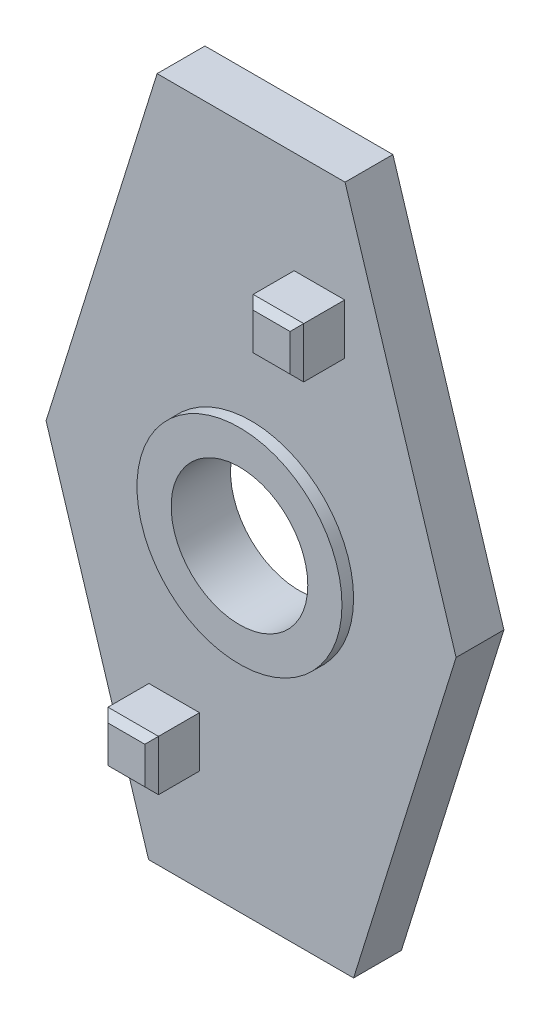
from build123d import *

# Parameters (mm, degrees)
SKETCH1_R           = 10
BOSS_EXTRUDE1_DEPTH = 7
SKETCH1_3_W         = 7.4
SKETCH1_3_H         = 7.4
BOSS_EXTRUDE2_DEPTH = 7
CHAMFER1_SIZE       = 1
BOSS_EXTRUDE3_START = 1.7
SKETCH1_4_R         = 15
SKETCH1_4_R_2       = 10
BOSS_EXTRUDE3_DEPTH = 1.7


with BuildPart() as part:
    # Sketch1 → Boss-Extrude1 (new body)
    with BuildSketch(Plane.XY):
        Polygon((-30, 0), (-15, -48.118283633), (15, -48.118283633), (30, 0), (13.753072731, 52.118283633), (-13.753072731, 52.118283633), align=None)
        Circle(SKETCH1_R, mode=Mode.SUBTRACT)
    extrude(amount=-BOSS_EXTRUDE1_DEPTH)

    # Sketch1<3> → Boss-Extrude2 (add)
    with BuildSketch(Plane.XY):
        with Locations((10.003072731, 33.468283633)):
            Rectangle(SKETCH1_3_W, SKETCH1_3_H)
        with Locations((-11.25, -29.468283633)):
            Rectangle(SKETCH1_3_W, SKETCH1_3_H)
    extrude(amount=BOSS_EXTRUDE2_DEPTH)

    # Chamfer1
    chamfer1_edges = [part.edges().sort_by_distance(p)[0] for p in [
        (13.703072731, 33.468283633, 7),
        (10.003072731, 29.768283633, 7),
        (6.303072731, 33.468283633, 7),
        (10.003072731, 37.168283633, 7),
        (-14.95, -29.468283633, 7),
        (-11.25, -25.768283633, 7),
        (-7.55, -29.468283633, 7),
        (-11.25, -33.168283633, 7),
    ]]
    chamfer(chamfer1_edges, length=CHAMFER1_SIZE)

    # Sketch1<4> → Boss-Extrude3 (add)
    with BuildSketch(Plane.XY.offset(BOSS_EXTRUDE3_START)):
        Circle(SKETCH1_4_R)
        Circle(SKETCH1_4_R_2, mode=Mode.SUBTRACT)
    extrude(amount=-BOSS_EXTRUDE3_DEPTH)


solid = part.part
